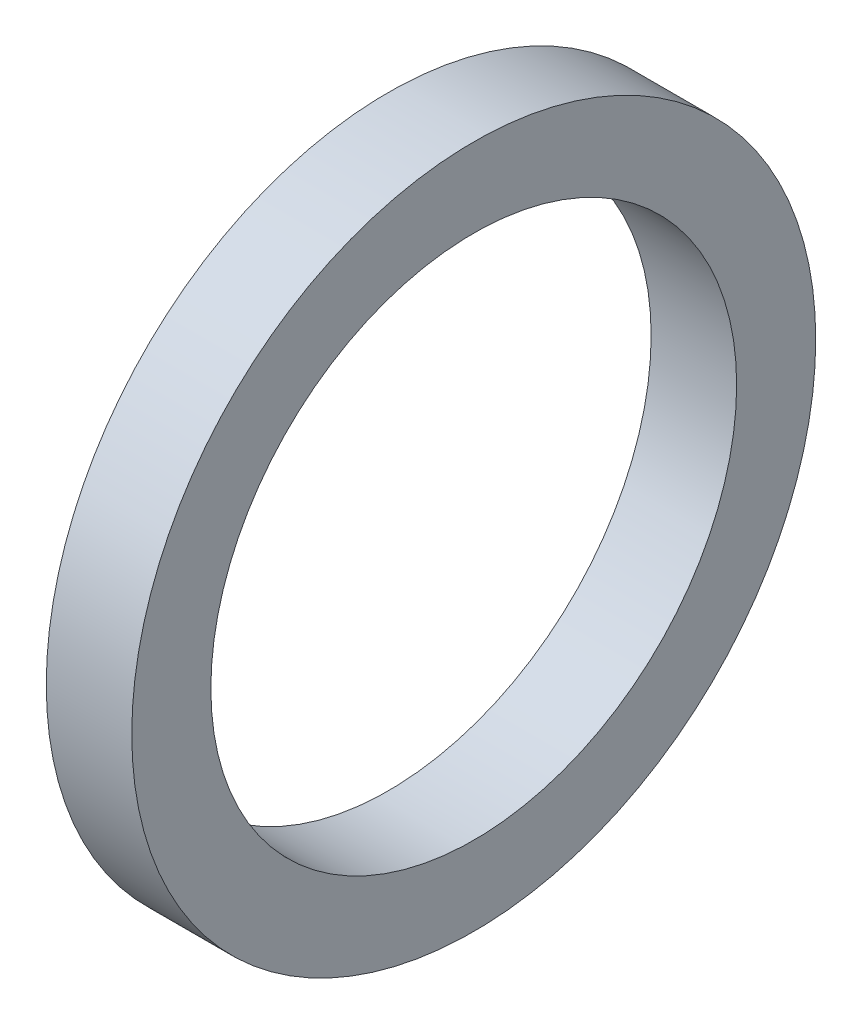
from build123d import *

# Parameters (mm, degrees)
SKETCH_1_R      = 8
SKETCH_1_R_2    = 6.15
EXTRUDE_1_DEPTH = 2


with BuildPart() as part:
    # ｽｹｯﾁ1 → ﾎﾞｽ - 押し出し1 (new body)
    with BuildSketch(Plane(origin=(0, 0, 0), x_dir=(0, 0, -1), z_dir=(1, 0, 0))):
        Circle(SKETCH_1_R)
        Circle(SKETCH_1_R_2, mode=Mode.SUBTRACT)
    extrude(amount=EXTRUDE_1_DEPTH)


solid = part.part
